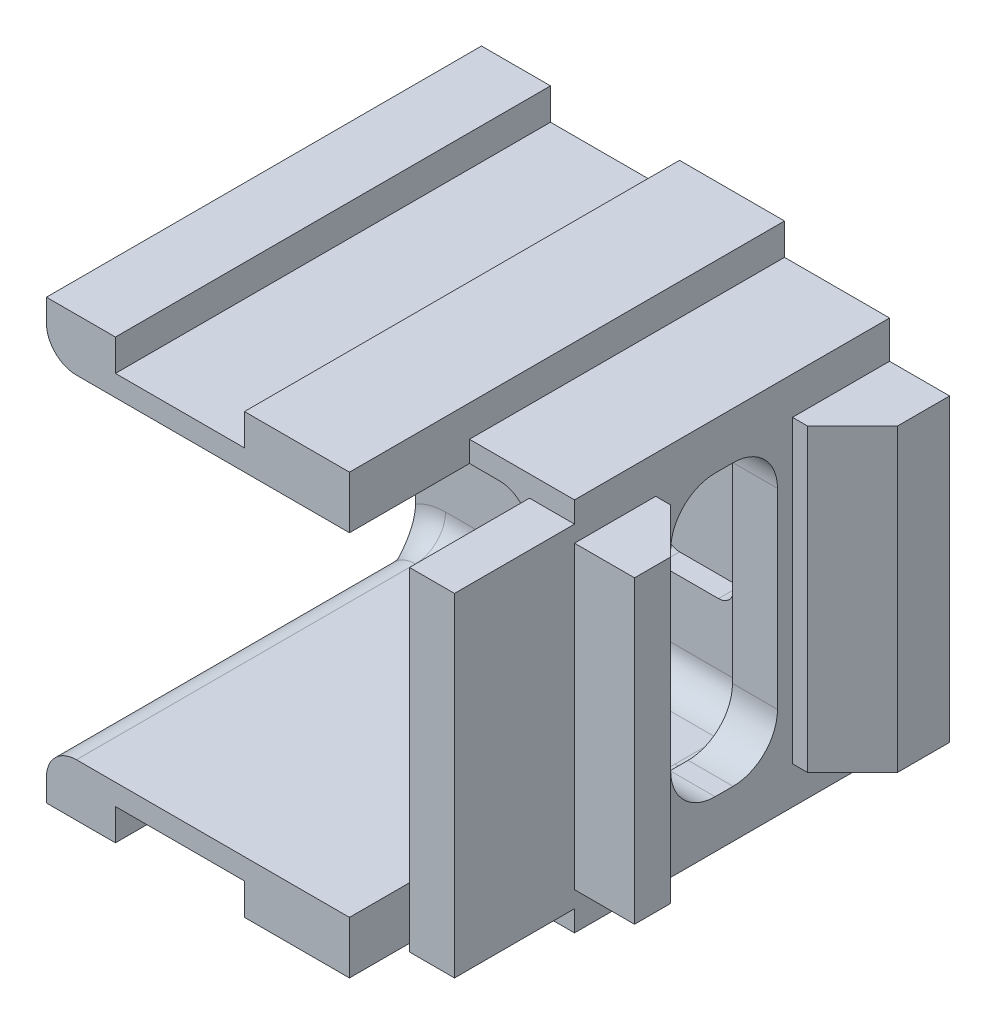
from build123d import *

# Parameters (mm, degrees)
SKETCH2_W                = 10
SKETCH2_H                = 10.5
BOSS_EXTRUDE1_DEPTH      = 2
SKETCH3_W                = 12.5
SKETCH3_H                = 14.5
BOSS_EXTRUDE2_DEPTH      = 3.5
SKETCH4_W                = 14.6
SKETCH4_H                = 14.5
BOSS_EXTRUDE3_DEPTH      = 3.5
SKETCH5_W                = 12.5
SKETCH5_H                = 14.5
BOSS_EXTRUDE4_DEPTH      = 4.3
BOSS_EXTRUDE5_DEPTH      = 2.3
SKETCH8_W                = 12.1
SKETCH8_H                = 11.1
CUT_EXTRUDE1_DEPTH       = 13
SKETCH10_W               = 3.5
SKETCH10_H               = 0.7
CUT_EXTRUDE6_DEPTH       = 4
FILLET1_R                = 1
CUT_EXTRUDE9_DEPTH       = 18.994790913
CUT_EXTRUDE9_DEPTH_BACK  = 18.994790913
SKETCH15_W               = 3
SKETCH15_H               = 5
BOSS_EXTRUDE6_DEPTH      = 0.7
FILLET5_R                = 0.5
FILLET3_R                = 1
FILLET4_R                = 1
CUT_EXTRUDE10_DEPTH      = 20.550255917
CUT_EXTRUDE10_DEPTH_BACK = 2
SKETCH14_W               = 4.56
SKETCH14_H               = 10
CHAMFER4_SIZE            = 1.5


with BuildPart() as part:
    # Sketch2 → Boss-Extrude1 (new body)
    with BuildSketch(Plane.YZ):
        Rectangle(SKETCH2_W, SKETCH2_H)
    extrude(amount=BOSS_EXTRUDE1_DEPTH)

    # Sketch3 → Boss-Extrude2 (add)
    with BuildSketch(Plane(origin=(0, 0, 0), x_dir=(0, -1, 0), z_dir=(-1, 0, 0))):
        with Locations((0, 2)):
            Rectangle(SKETCH3_W, SKETCH3_H)
    extrude(amount=BOSS_EXTRUDE2_DEPTH)

    # Sketch4 → Boss-Extrude3 (add)
    with BuildSketch(Plane(origin=(-3.5, 0, 0), x_dir=(0, -1, 0), z_dir=(-1, 0, 0))):
        with Locations((0, 2)):
            Rectangle(SKETCH4_W, SKETCH4_H)
    extrude(amount=BOSS_EXTRUDE3_DEPTH)

    # Sketch5 → Boss-Extrude4 (add)
    with BuildSketch(Plane(origin=(-7, 0, 0), x_dir=(0, -1, 0), z_dir=(-1, 0, 0))):
        with Locations((0, 2)):
            Rectangle(SKETCH5_W, SKETCH5_H)
    extrude(amount=BOSS_EXTRUDE4_DEPTH)

    # Sketch6 → Boss-Extrude5 (add)
    with BuildSketch(Plane(origin=(-11.3, 0, 0), x_dir=(0, -1, 0), z_dir=(-1, 0, 0))):
        Polygon((6.25, -5.25), (7.3, -5.25), (7.3, 9.25), (6.25, 9.25), (-6.25, 9.25), (-7.3, 9.25), (-7.3, -5.25), (-6.25, -5.25), align=None)
    extrude(amount=BOSS_EXTRUDE5_DEPTH)

    # Sketch8 → Cut-Extrude1 (cut)
    with BuildSketch(Plane.XY.offset(9.25)):
        with Locations((-7.55, 0)):
            Rectangle(SKETCH8_W, SKETCH8_H)
    extrude(amount=-CUT_EXTRUDE1_DEPTH, mode=Mode.SUBTRACT)

    # Sketch10 → Cut-Extrude6 (cut)
    with BuildSketch(Plane.XY.offset(9.25)):
        with Locations((-1.75, 5.9)):
            Rectangle(SKETCH10_W, SKETCH10_H)
        with Locations((-1.75, -5.9)):
            Rectangle(SKETCH10_W, SKETCH10_H)
    extrude(amount=-CUT_EXTRUDE6_DEPTH, mode=Mode.SUBTRACT)

    # Fillet1
    fillet1_edges = [part.edges().sort_by_distance(p)[0] for p in [
        (-13.6, -5.55, 2.75),
        (-13.6, 5.55, 2.75),
    ]]
    fillet(fillet1_edges, radius=FILLET1_R)

    # Sketch13 → Cut-Extrude9 (cut, two sides: drawn at the far end of the back side and taken through both)
    with BuildSketch(Plane(origin=(0, 0, 0), x_dir=(0, 0, -1), z_dir=(1, 0, 0)).offset(-CUT_EXTRUDE9_DEPTH_BACK)):
        with BuildLine():
            Line((-2.045, 0.01001), (-2.045, -3.17999))
            ThreePointArc((-2.045, -3.17999), (-1.611518036, -4.226508036), (-0.565, -4.65999))
            Line((-0.565, -4.65999), (0.035, -4.65999))
            ThreePointArc((0.035, -4.65999), (1.081518036, -4.226508036), (1.515, -3.17999))
            Line((1.515, -3.17999), (1.515, 0.01001))
            Line((1.515, 0.01001), (1.515, 3.20001))
            ThreePointArc((1.515, 3.20001), (1.081518036, 4.246528036), (0.035, 4.68001))
            Line((0.035, 4.68001), (-0.565, 4.68001))
            ThreePointArc((-0.565, 4.68001), (-1.611518036, 4.246528036), (-2.045, 3.20001))
            Line((-2.045, 3.20001), (-2.045, 0.01001))
        make_face()
    extrude(amount=CUT_EXTRUDE9_DEPTH + CUT_EXTRUDE9_DEPTH_BACK, mode=Mode.SUBTRACT)

    # Sketch15 → Boss-Extrude6 (add)
    with BuildSketch(Plane.XY.offset(-3.75)):
        with BuildLine():
            Line((-13.6, 6.55), (-13.6, -6.55))
            ThreePointArc((-13.6, -6.55), (-13.307106781, -5.842893219), (-12.6, -5.55))
            Line((-12.6, -5.55), (-1.5, -5.55))
            Line((-1.5, -5.55), (-1.5, 5.55))
            Line((-1.5, 5.55), (-12.6, 5.55))
            ThreePointArc((-12.6, 5.55), (-13.307106781, 5.842893219), (-13.6, 6.55))
        make_face()
        with Locations((-4.5, 0)):
            Rectangle(SKETCH15_W, SKETCH15_H, mode=Mode.SUBTRACT)
    extrude(amount=BOSS_EXTRUDE6_DEPTH)

    # Fillet5
    fillet5_edges = [part.edges().sort_by_distance(p)[0] for p in [
        (-3, 2.5, -3.4),
        (-6, 2.5, -3.4),
        (-6, -2.5, -3.4),
        (-3, -2.5, -3.4),
    ]]
    fillet(fillet5_edges, radius=FILLET5_R)

    # Fillet3
    fillet3_edges = [part.edges().sort_by_distance(p)[0] for p in [
        (-1.5, -5.55, 1.1),
        (-1.5, 5.55, 1.1),
    ]]
    fillet(fillet3_edges, radius=FILLET3_R)

    # Fillet4
    fillet4_edges = [part.edges().sort_by_distance(p)[0] for p in [
        (-13.307106781, 5.842893219, -3.05),
        (-13.307106781, -5.842893219, -3.05),
        (-7.55, -5.55, -3.05),
        (-7.55, 5.55, -3.05),
        (-1.5, 0, -3.05),
        (-1.792893219, -5.257106781, -3.05),
        (-1.792893219, 5.257106781, -3.05),
    ]]
    fillet(fillet4_edges, radius=FILLET4_R)

    # Sketch14 → Cut-Extrude10 (cut, two sides: drawn at the far end of the back side and taken through both)
    with BuildSketch(Plane(origin=(2, 0, 0), x_dir=(0, 0, -1), z_dir=(1, 0, 0)).offset(-CUT_EXTRUDE10_DEPTH_BACK)):
        with Locations((-0.265, 0)):
            Rectangle(SKETCH14_W, SKETCH14_H)
    extrude(amount=CUT_EXTRUDE10_DEPTH + CUT_EXTRUDE10_DEPTH_BACK, mode=Mode.SUBTRACT)

    # Chamfer4
    chamfer4_edges = [part.edges().sort_by_distance(p)[0] for p in [
        (2, 0, 2.545),
        (2, 0, -2.015),
    ]]
    chamfer(chamfer4_edges, length=CHAMFER4_SIZE)


solid = part.part
